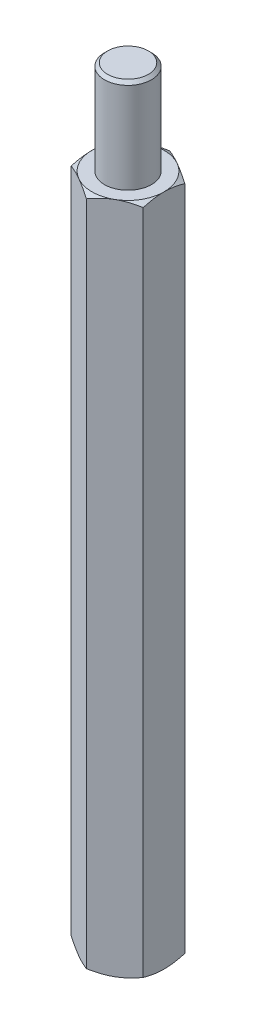
from build123d import *

# Parameters (mm, degrees)
EXTRUDE_1_DEPTH      = 43
SKETCH_2_R           = 1.5
EXTRUDE_2_DEPTH      = 6
CHAMFER_1_SIZE       = 0.2
SKETCH_3_R           = 1.229375
CUT_EXTRUDE_1_DEPTH  = 6
SKETCH_4_OUTSIDE_W   = 26.892
SKETCH_4_OUTSIDE_H   = 27.604
SKETCH_4_OUTSIDE_R   = 2.3
CUT_EXTRUDE_2_DEPTH  = 3
CUT_EXTRUDE_2_DRAFT  = -60
CUT_EXTRUDE_START    = -43
SKETCH_4_2_OUTSIDE_W = 26.892
SKETCH_4_2_OUTSIDE_H = 27.604
SKETCH_4_2_OUTSIDE_R = 2.3
CUT_EXTRUDE_3_DEPTH  = 3
CUT_EXTRUDE_3_DRAFT  = 60
CHAMFER_2_SIZE       = 0.2


with BuildPart() as part:
    # 草图1 → 凸台-拉伸1 (new body)
    with BuildSketch(Plane(origin=(0, 0, 0), x_dir=(1, 0, 0), z_dir=(0, 1, 0))):
        Polygon((0, 2.655811238), (-2.3, 1.327905619), (-2.3, -1.327905619), (0, -2.655811238), (2.3, -1.327905619), (2.3, 1.327905619), align=None)
    extrude(amount=EXTRUDE_1_DEPTH)

    # 草图2 → 凸台-拉伸2 (add)
    with BuildSketch(Plane(origin=(0, 43, 0), x_dir=(1, 0, 0), z_dir=(0, 1, 0))):
        with Locations(Location((0, 0, 0), (0, 0, 270))):
            Circle(SKETCH_2_R)
    extrude(amount=EXTRUDE_2_DEPTH)

    # 倒角1
    chamfer_1_edges = [part.edges().sort_by_distance(p)[0] for p in [
        (0, 49, -1.5),
    ]]
    chamfer(chamfer_1_edges, length=CHAMFER_1_SIZE)

    # 草图3 → 切除-拉伸1 (cut)
    with BuildSketch(Plane.XZ):
        with Locations(Location((0, 0, 0), (0, 0, 270))):
            Circle(SKETCH_3_R)
    extrude(amount=-CUT_EXTRUDE_1_DEPTH, mode=Mode.SUBTRACT)


with BuildPart() as cut_extrude_2_tool:
    # 草图4 outside → 切除-拉伸2 (with draft: the straight prism first)
    with BuildSketch(Plane.XZ):
        Rectangle(SKETCH_4_OUTSIDE_W, SKETCH_4_OUTSIDE_H)
        Circle(SKETCH_4_OUTSIDE_R, mode=Mode.SUBTRACT)
    extrude(amount=-CUT_EXTRUDE_2_DEPTH)
    # 切除-拉伸2: the draft: its side faces are tilted about the plane it starts from
    cut_extrude_2_sides = [cut_extrude_2_tool.faces().sort_by_distance(p)[0] for p in [
        (0, 1.5, -13.802),
        (13.446, 1.5, 0),
        (0, 1.5, 13.802),
        (-13.446, 1.5, 0),
        (-2.3, 1.5, 0),
    ]]
    draft(cut_extrude_2_sides, Plane.XZ, CUT_EXTRUDE_2_DRAFT)


with BuildPart() as part_1:
    add(part.part)

    # 切除-拉伸2: cut by cut_extrude_2_tool
    add(cut_extrude_2_tool.part, mode=Mode.SUBTRACT)


with BuildPart() as cut_extrude_3_tool:
    # 草图4<2> outside → 切除-拉伸3 (with draft: the straight prism first)
    with BuildSketch(Plane.XZ.offset(CUT_EXTRUDE_START)):
        Rectangle(SKETCH_4_2_OUTSIDE_W, SKETCH_4_2_OUTSIDE_H)
        Circle(SKETCH_4_2_OUTSIDE_R, mode=Mode.SUBTRACT)
    extrude(amount=CUT_EXTRUDE_3_DEPTH)
    # 切除-拉伸3: the draft: its side faces are tilted about the plane it starts from
    cut_extrude_3_sides = [cut_extrude_3_tool.faces().sort_by_distance(p)[0] for p in [
        (0, 41.5, -13.802),
        (13.446, 41.5, 0),
        (0, 41.5, 13.802),
        (-13.446, 41.5, 0),
        (-2.3, 41.5, 0),
    ]]
    draft(cut_extrude_3_sides, Plane.XZ.offset(CUT_EXTRUDE_START), CUT_EXTRUDE_3_DRAFT)


with BuildPart() as part_2:
    add(part_1.part)

    # 切除-拉伸3: cut by cut_extrude_3_tool
    add(cut_extrude_3_tool.part, mode=Mode.SUBTRACT)

    # 倒角2
    chamfer_2_edges = [part_2.edges().sort_by_distance(p)[0] for p in [
        (0, 0, 1.229375),
    ]]
    chamfer(chamfer_2_edges, length=CHAMFER_2_SIZE)


solid = part_2.part
